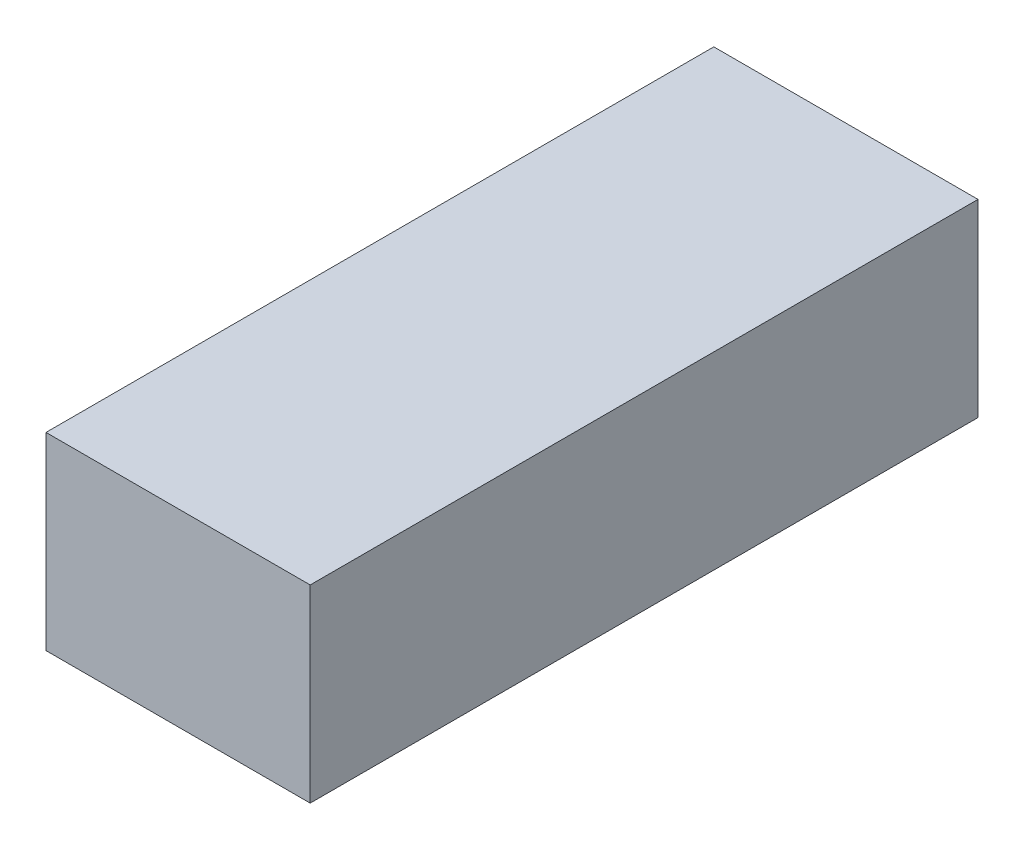
from build123d import *

# Parameters (mm, degrees)
SKETCH1_W           = 72
SKETCH1_H           = 182
BOSS_EXTRUDE1_DEPTH = 25.75


with BuildPart() as part:
    # Sketch1 → Boss-Extrude1 (new, symmetric)
    with BuildSketch(Plane(origin=(0, 0, 0), x_dir=(1, 0, 0), z_dir=(0, 1, 0))):
        Rectangle(SKETCH1_W, SKETCH1_H)
    extrude(amount=BOSS_EXTRUDE1_DEPTH, both=True)


solid = part.part
